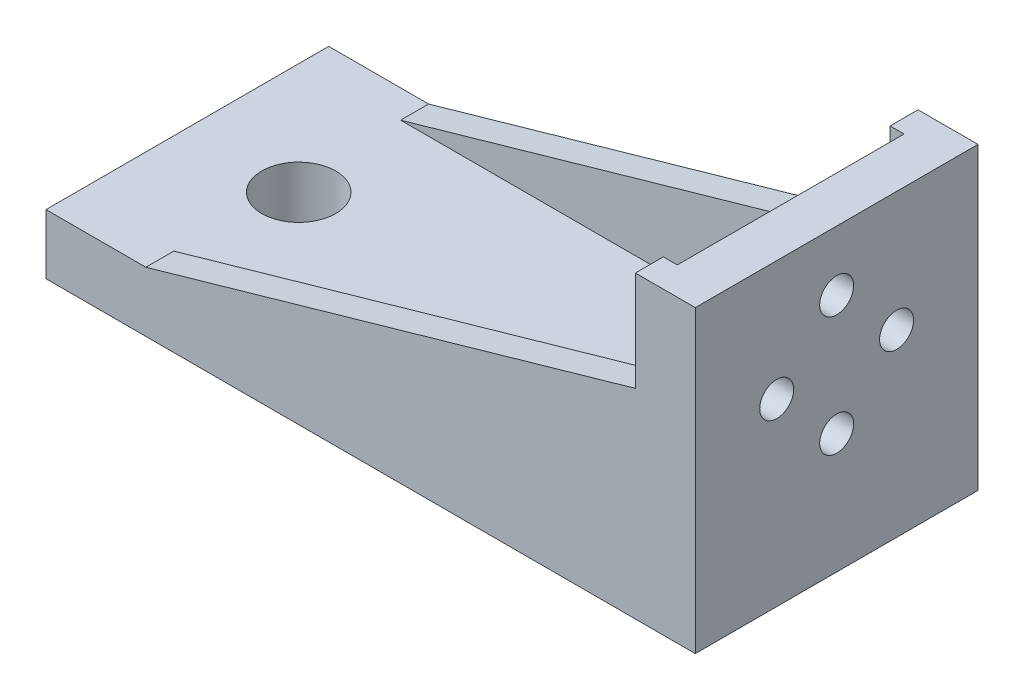
from build123d import *

# Parameters (mm, degrees)
EXTRUDE_1_DEPTH     = 14.15
SKETCH_2_W          = 60.4
SKETCH_2_H          = 24
CUT_EXTRUDE_1_DEPTH = 11.35
CUT_EXTRUDE_2_REACH = 74.974
SKETCH_4_R          = 2.55
SKETCH_4_R_2        = 3.7
CUT_EXTRUDE_3_REACH = 74.974
SKETCH_5_R          = 1.7


with BuildPart() as part:
    # 草图1 → 凸台-拉伸1 (new, symmetric)
    with BuildSketch(Plane.XY):
        Polygon((0, 0), (65, 0), (65, 30), (59, 30), (59, 20), (10, 6), (0, 6), align=None)
    extrude(amount=EXTRUDE_1_DEPTH, both=True)

    # 草图2 → 切除-拉伸1 (cut, symmetric)
    with BuildSketch(Plane.XY):
        with Locations((30.2, 18)):
            Rectangle(SKETCH_2_W, SKETCH_2_H)
    extrude(amount=CUT_EXTRUDE_1_DEPTH, both=True, mode=Mode.SUBTRACT)

    # 草图4 → 切除-拉伸2 (cut, up to next)
    with BuildSketch(Plane(origin=(0, 0, 0), x_dir=(1, 0, 0), z_dir=(0, 1, 0)), mode=Mode.PRIVATE) as cut_extrude_2_sk1:
        with Locations((50.85, 0)):
            Circle(SKETCH_4_R)
    cut_extrude_2_tool1 = extrude(cut_extrude_2_sk1.sketch, amount=CUT_EXTRUDE_2_REACH, mode=Mode.PRIVATE) & part.part
    # 草图4 → 切除-拉伸2 (cut, up to next)
    with BuildSketch(Plane(origin=(0, 0, 0), x_dir=(1, 0, 0), z_dir=(0, 1, 0)), mode=Mode.PRIVATE) as cut_extrude_2_sk2:
        with Locations((11.15, 0)):
            Circle(SKETCH_4_R_2)
    cut_extrude_2_tool2 = extrude(cut_extrude_2_sk2.sketch, amount=CUT_EXTRUDE_2_REACH, mode=Mode.PRIVATE) & part.part
    add(cut_extrude_2_tool1.solids().sort_by_distance((50.85, 0, 0))[0], mode=Mode.SUBTRACT)
    add(cut_extrude_2_tool2.solids().sort_by_distance((11.15, 0, 0))[0], mode=Mode.SUBTRACT)

    # 草图5 → 切除-拉伸3 (cut, up to next)
    with BuildSketch(Plane(origin=(0, 0, 0), x_dir=(0, 0, -1), z_dir=(1, 0, 0)), mode=Mode.PRIVATE) as cut_extrude_3_sk1:
        with Locations(Location((0, 24, 0), (0, 0, 180))):
            Circle(SKETCH_5_R)
    cut_extrude_3_tool1 = extrude(cut_extrude_3_sk1.sketch, amount=CUT_EXTRUDE_3_REACH, mode=Mode.PRIVATE) & part.part
    # 草图5 → 切除-拉伸3 (cut, up to next)
    with BuildSketch(Plane(origin=(0, 0, 0), x_dir=(0, 0, -1), z_dir=(1, 0, 0)), mode=Mode.PRIVATE) as cut_extrude_3_sk2:
        with Locations(Location((0, 12, 0), (0, 0, 180))):
            Circle(SKETCH_5_R)
    cut_extrude_3_tool2 = extrude(cut_extrude_3_sk2.sketch, amount=CUT_EXTRUDE_3_REACH, mode=Mode.PRIVATE) & part.part
    # 草图5 → 切除-拉伸3 (cut, up to next)
    with BuildSketch(Plane(origin=(0, 0, 0), x_dir=(0, 0, -1), z_dir=(1, 0, 0)), mode=Mode.PRIVATE) as cut_extrude_3_sk3:
        with Locations(Location((-6, 18, 0), (0, 0, 180))):
            Circle(SKETCH_5_R)
    cut_extrude_3_tool3 = extrude(cut_extrude_3_sk3.sketch, amount=CUT_EXTRUDE_3_REACH, mode=Mode.PRIVATE) & part.part
    # 草图5 → 切除-拉伸3 (cut, up to next)
    with BuildSketch(Plane(origin=(0, 0, 0), x_dir=(0, 0, -1), z_dir=(1, 0, 0)), mode=Mode.PRIVATE) as cut_extrude_3_sk4:
        with Locations(Location((6, 18, 0), (0, 0, 180))):
            Circle(SKETCH_5_R)
    cut_extrude_3_tool4 = extrude(cut_extrude_3_sk4.sketch, amount=CUT_EXTRUDE_3_REACH, mode=Mode.PRIVATE) & part.part
    add(cut_extrude_3_tool1.solids().sort_by_distance((0, 24, 0))[0], mode=Mode.SUBTRACT)
    add(cut_extrude_3_tool2.solids().sort_by_distance((0, 12, 0))[0], mode=Mode.SUBTRACT)
    add(cut_extrude_3_tool3.solids().sort_by_distance((0, 18, 6))[0], mode=Mode.SUBTRACT)
    add(cut_extrude_3_tool4.solids().sort_by_distance((0, 18, -6))[0], mode=Mode.SUBTRACT)


solid = part.part
